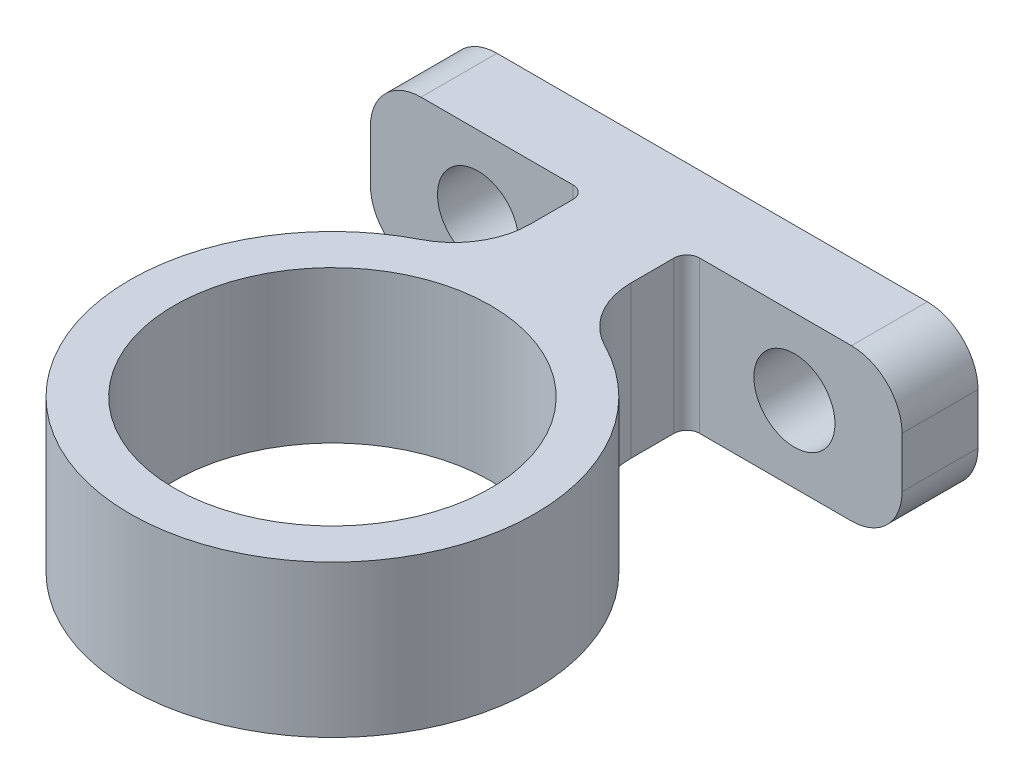
from build123d import *

# Parameters (mm, degrees)
SKETCH_1_W          = 21
SKETCH_1_H          = 6
EXTRUDE_1_DEPTH     = 3
SKETCH_2_R          = 6.25
EXTRUDE_2_DEPTH     = 6
SKETCH_4_R          = 1.6
CUT_EXTRUDE_1_DEPTH = 3
FILLET_1_R          = 0.5
FILLET_2_R          = 3
FILLET_3_R          = 2


with BuildPart() as part:
    # 草图1 → 凸台-拉伸1 (new body)
    with BuildSketch(Plane.XY):
        with Locations((0, -30.20649321)):
            Rectangle(SKETCH_1_W, SKETCH_1_H)
    extrude(amount=EXTRUDE_1_DEPTH)

    # 草图2 → 凸台-拉伸2 (add)
    with BuildSketch(Plane.XZ.offset(33.20649321)):
        with BuildLine():
            ThreePointArc((2, 7.254033308), (0, 23), (-2, 7.254033308))
            Line((-2, 7.254033308), (-2, 3))
            Line((-2, 3), (2, 3))
            Line((2, 3), (2, 7.254033308))
        make_face()
        with Locations(Location((0, 15, 0), (0, 0, 270))):
            Circle(SKETCH_2_R, mode=Mode.SUBTRACT)
    extrude(amount=-EXTRUDE_2_DEPTH)

    # 草图4 → 切除-拉伸1 (cut)
    with BuildSketch(Plane(origin=(0, 0, 0), x_dir=(-1, 0, 0), z_dir=(0, 0, -1))):
        with Locations((-6.25, -30.20649321)):
            Circle(SKETCH_4_R)
        with Locations(Location((6.25, -30.20649321, 0), (0, 0, 180))):
            Circle(SKETCH_4_R)
    extrude(amount=-CUT_EXTRUDE_1_DEPTH, mode=Mode.SUBTRACT)

    # 圆角1
    fillet_1_edges = [part.edges().sort_by_distance(p)[0] for p in [
        (-2, -30.20649321, 3),
        (2, -30.20649321, 3),
    ]]
    fillet(fillet_1_edges, radius=FILLET_1_R)

    # 圆角2
    fillet_2_edges = [part.edges().sort_by_distance(p)[0] for p in [
        (2, -30.20649321, 7.254033308),
        (-2, -30.20649321, 7.254033308),
    ]]
    fillet(fillet_2_edges, radius=FILLET_2_R)

    # 圆角3
    fillet_3_edges = [part.edges().sort_by_distance(p)[0] for p in [
        (10.5, -33.20649321, 1.5),
        (-10.5, -33.20649321, 1.5),
        (-10.5, -27.20649321, 1.5),
        (10.5, -27.20649321, 1.5),
    ]]
    fillet(fillet_3_edges, radius=FILLET_3_R)


solid = part.part
